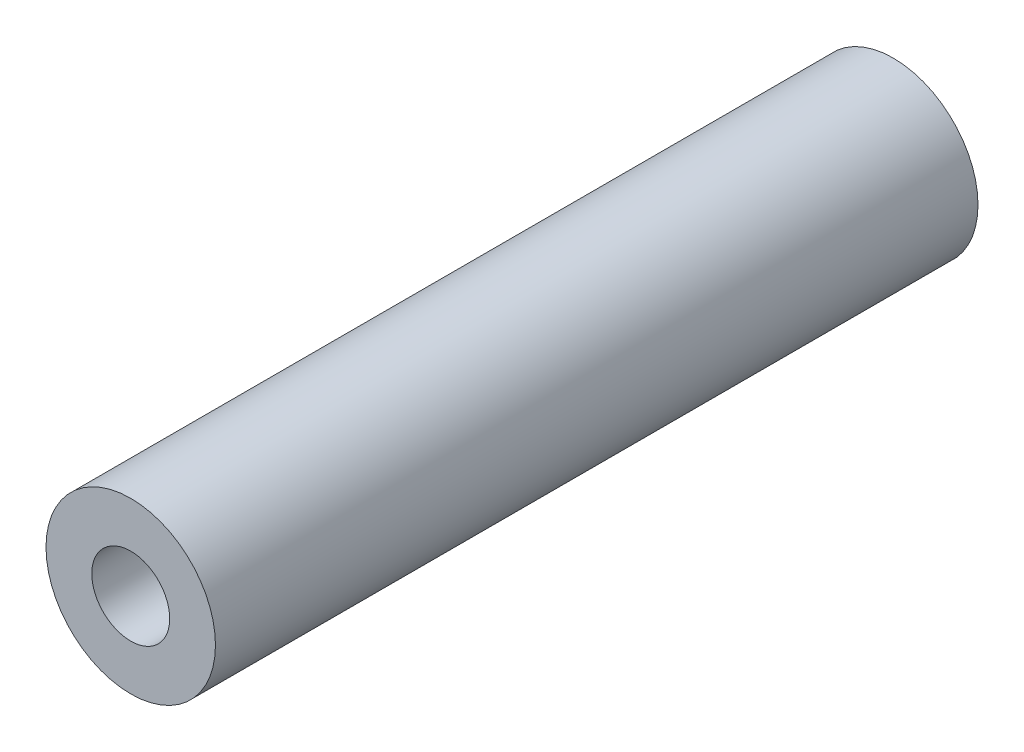
from build123d import *

# Parameters (mm, degrees)
EXTRUDE1_DEPTH      = 14.2875
EXTRUDE1_DEPTH_BACK = 14.2875
SKETCH1_R           = 3.175
SKETCH1_R_2         = 1.4605


with BuildPart() as part:
    # Sketch1 → Extrude1 (new, two sides: drawn at the far end of the back side and taken through both)
    with BuildSketch(Plane.XY.offset(-EXTRUDE1_DEPTH_BACK)):
        Circle(SKETCH1_R)
        Circle(SKETCH1_R_2, mode=Mode.SUBTRACT)
    extrude(amount=EXTRUDE1_DEPTH + EXTRUDE1_DEPTH_BACK)


solid = part.part
